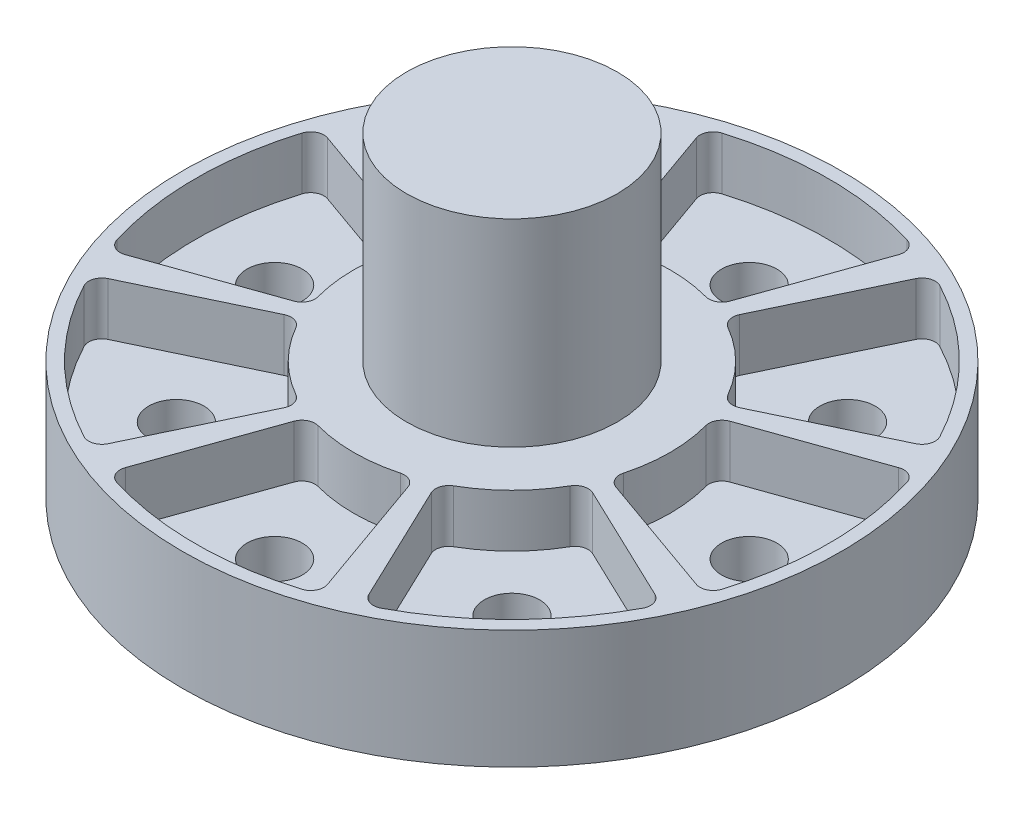
from build123d import *

# Parameters (mm, degrees)
SKETCH_1_R      = 25
SKETCH_1_R_2    = 2.1
EXTRUDE_1_DEPTH = 5
SKETCH_2_R      = 25
SKETCH_2_R_2    = 24
SKETCH_2_R_3    = 12
EXTRUDE_2_DEPTH = 4
FILLET_1_R      = 1
SKETCH_3_R      = 8
EXTRUDE_3_DEPTH = 15


with BuildPart() as part:
    # Эскиз1 → Бобышка-Вытянуть1 (new body)
    with BuildSketch(Plane(origin=(0, 0, 0), x_dir=(1, 0, 0), z_dir=(0, 1, 0))):
        with Locations(Location((0, 0, 0), (0, 0, 270))):
            Circle(SKETCH_1_R)
        with Locations(Location((-18, 0, 0), (0, 0, 270))):
            Circle(SKETCH_1_R_2, mode=Mode.SUBTRACT)
        with Locations(Location((-12.727922061, 12.727922061, 0), (0, 0, 270))):
            Circle(SKETCH_1_R_2, mode=Mode.SUBTRACT)
        with Locations(Location((0, 18, 0), (0, 0, 270))):
            Circle(SKETCH_1_R_2, mode=Mode.SUBTRACT)
        with Locations(Location((12.727922061, 12.727922061, 0), (0, 0, 270))):
            Circle(SKETCH_1_R_2, mode=Mode.SUBTRACT)
        with Locations(Location((18, 0, 0), (0, 0, 270))):
            Circle(SKETCH_1_R_2, mode=Mode.SUBTRACT)
        with Locations(Location((12.727922061, -12.727922061, 0), (0, 0, 270))):
            Circle(SKETCH_1_R_2, mode=Mode.SUBTRACT)
        with Locations(Location((0, -18, 0), (0, 0, 270))):
            Circle(SKETCH_1_R_2, mode=Mode.SUBTRACT)
        with Locations(Location((-12.727922061, -12.727922061, 0), (0, 0, 270))):
            Circle(SKETCH_1_R_2, mode=Mode.SUBTRACT)
    extrude(amount=EXTRUDE_1_DEPTH)

    # Эскиз2 → Бобышка-Вытянуть2 (add)
    # profile 1 of 10: a face of its own
    with BuildSketch(Plane(origin=(0, 5, 0), x_dir=(1, 0, 0), z_dir=(0, 1, 0))):
        with Locations(Location((0, 0, 0), (0, 0, 270))):
            Circle(SKETCH_2_R)
        Circle(SKETCH_2_R_2, mode=Mode.SUBTRACT)
    # profile 2 of 10: a face of its own
    with BuildSketch(Plane(origin=(0, 5, 0), x_dir=(1, 0, 0), z_dir=(0, 1, 0))):
        Circle(SKETCH_2_R_3)
    # profile 3 of 10: a face of its own
    with BuildSketch(Plane(origin=(0, 5, 0), x_dir=(1, 0, 0), z_dir=(0, 1, 0))):
        with BuildLine():
            Line((-10.332266323, 21.662046824), (-5.166133162, 10.831023412))
            ThreePointArc((-5.166133162, 10.831023412), (-4.592201188, 11.08655439), (-4.005682311, 11.311697893))
            Line((-4.005682311, 11.311697893), (-8.011364622, 22.623395786))
            ThreePointArc((-8.011364622, 22.623395786), (-9.184402377, 22.17310878), (-10.332266323, 21.662046824))
        make_face()
    # profile 4 of 10: a face of its own
    with BuildSketch(Plane(origin=(0, 5, 0), x_dir=(1, 0, 0), z_dir=(0, 1, 0))):
        with BuildLine():
            Line((8.011364622, 22.623395786), (4.005682311, 11.311697893))
            ThreePointArc((4.005682311, 11.311697893), (4.592201188, 11.08655439), (5.166133162, 10.831023412))
            Line((5.166133162, 10.831023412), (10.332266323, 21.662046824))
            ThreePointArc((10.332266323, 21.662046824), (9.184402377, 22.17310878), (8.011364622, 22.623395786))
        make_face()
    # profile 5 of 10: a face of its own
    with BuildSketch(Plane(origin=(0, 5, 0), x_dir=(1, 0, 0), z_dir=(0, 1, 0))):
        with BuildLine():
            ThreePointArc((10.831023412, 5.166133162), (11.08655439, 4.592201188), (11.311697893, 4.005682311))
            Line((11.311697893, 4.005682311), (22.623395786, 8.011364622))
            ThreePointArc((22.623395786, 8.011364622), (22.17310878, 9.184402377), (21.662046824, 10.332266323))
            Line((21.662046824, 10.332266323), (10.831023412, 5.166133162))
        make_face()
    # profile 6 of 10: a face of its own
    with BuildSketch(Plane(origin=(0, 5, 0), x_dir=(1, 0, 0), z_dir=(0, 1, 0))):
        with BuildLine():
            ThreePointArc((11.311697893, -4.005682311), (11.08655439, -4.592201188), (10.831023412, -5.166133162))
            Line((10.831023412, -5.166133162), (21.662046824, -10.332266323))
            ThreePointArc((21.662046824, -10.332266323), (22.17310878, -9.184402377), (22.623395786, -8.011364622))
            Line((22.623395786, -8.011364622), (11.311697893, -4.005682311))
        make_face()
    # profile 7 of 10: a face of its own
    with BuildSketch(Plane(origin=(0, 5, 0), x_dir=(1, 0, 0), z_dir=(0, 1, 0))):
        with BuildLine():
            ThreePointArc((5.166133162, -10.831023412), (4.592201188, -11.08655439), (4.005682311, -11.311697893))
            Line((4.005682311, -11.311697893), (8.011364622, -22.623395786))
            ThreePointArc((8.011364622, -22.623395786), (9.184402377, -22.17310878), (10.332266323, -21.662046824))
            Line((10.332266323, -21.662046824), (5.166133162, -10.831023412))
        make_face()
    # profile 8 of 10: a face of its own
    with BuildSketch(Plane(origin=(0, 5, 0), x_dir=(1, 0, 0), z_dir=(0, 1, 0))):
        with BuildLine():
            ThreePointArc((-4.005682311, -11.311697893), (-4.592201188, -11.08655439), (-5.166133162, -10.831023412))
            Line((-5.166133162, -10.831023412), (-10.332266323, -21.662046824))
            ThreePointArc((-10.332266323, -21.662046824), (-9.184402377, -22.17310878), (-8.011364622, -22.623395786))
            Line((-8.011364622, -22.623395786), (-4.005682311, -11.311697893))
        make_face()
    # profile 9 of 10: a face of its own
    with BuildSketch(Plane(origin=(0, 5, 0), x_dir=(1, 0, 0), z_dir=(0, 1, 0))):
        with BuildLine():
            Line((-21.662046824, -10.332266323), (-10.831023412, -5.166133162))
            ThreePointArc((-10.831023412, -5.166133162), (-11.08655439, -4.592201188), (-11.311697893, -4.005682311))
            Line((-11.311697893, -4.005682311), (-22.623395786, -8.011364622))
            ThreePointArc((-22.623395786, -8.011364622), (-22.17310878, -9.184402377), (-21.662046824, -10.332266323))
        make_face()
    # profile 10 of 10: a face of its own
    with BuildSketch(Plane(origin=(0, 5, 0), x_dir=(1, 0, 0), z_dir=(0, 1, 0))):
        with BuildLine():
            Line((-22.623395786, 8.011364622), (-11.311697893, 4.005682311))
            ThreePointArc((-11.311697893, 4.005682311), (-11.08655439, 4.592201188), (-10.831023412, 5.166133162))
            Line((-10.831023412, 5.166133162), (-21.662046824, 10.332266323))
            ThreePointArc((-21.662046824, 10.332266323), (-22.17310878, 9.184402377), (-22.623395786, 8.011364622))
        make_face()
    extrude(amount=EXTRUDE_2_DEPTH)

    # Скругление1
    fillet_1_edges = [part.edges().sort_by_distance(p)[0] for p in [
        (5.166133162, 7, 10.831023412),
        (10.831023412, 7, 5.166133162),
        (21.662046824, 7, 10.332266323),
        (22.623395786, 7, 8.011364622),
        (11.311697893, 7, 4.005682311),
        (11.311697893, 7, -4.005682311),
        (21.662046824, 7, -10.332266323),
        (10.831023412, 7, -5.166133162),
        (5.166133162, 7, -10.831023412),
        (8.011364622, 7, -22.623395786),
        (4.005682311, 7, -11.311697893),
        (-4.005682311, 7, -11.311697893),
        (-10.332266323, 7, -21.662046824),
        (-5.166133162, 7, -10.831023412),
        (-10.831023412, 7, -5.166133162),
        (-22.623395786, 7, -8.011364622),
        (-11.311697893, 7, -4.005682311),
        (-11.311697893, 7, 4.005682311),
        (-21.662046824, 7, 10.332266323),
        (-10.831023412, 7, 5.166133162),
        (-5.166133162, 7, 10.831023412),
        (-8.011364622, 7, 22.623395786),
        (-4.005682311, 7, 11.311697893),
        (4.005682311, 7, 11.311697893),
        (10.332266323, 7, 21.662046824),
        (22.623395786, 7, -8.011364622),
        (10.332266323, 7, -21.662046824),
        (-8.011364622, 7, -22.623395786),
        (-21.662046824, 7, -10.332266323),
        (-22.623395786, 7, 8.011364622),
        (-10.332266323, 7, 21.662046824),
        (8.011364622, 7, 22.623395786),
    ]]
    fillet(fillet_1_edges, radius=FILLET_1_R)

    # Эскиз3 → Бобышка-Вытянуть3 (add)
    with BuildSketch(Plane(origin=(0, 9, 0), x_dir=(1, 0, 0), z_dir=(0, 1, 0))):
        with Locations(Location((0, 0, 0), (0, 0, 270))):
            Circle(SKETCH_3_R)
    extrude(amount=EXTRUDE_3_DEPTH)


solid = part.part
